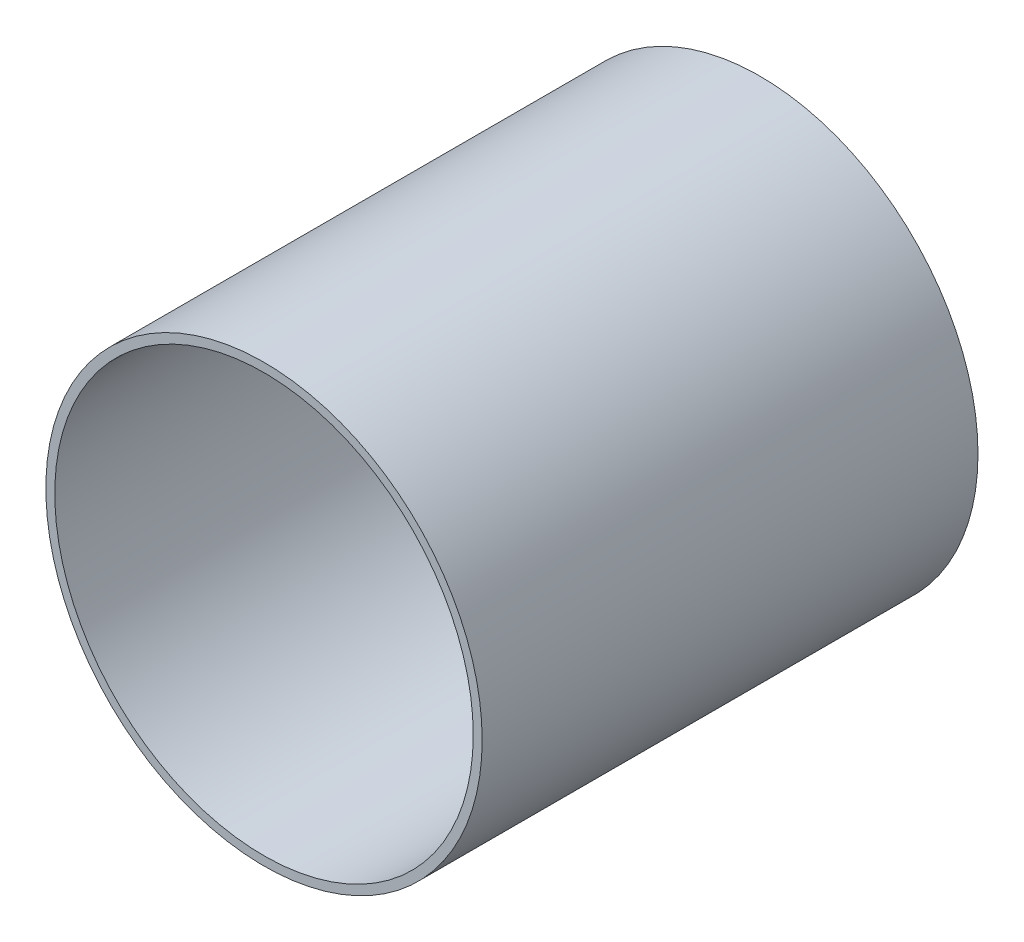
from build123d import *

# Parameters (mm, degrees)
SKETCH1_R           = 11
SKETCH1_R_2         = 10.55
BOSS_EXTRUDE1_DEPTH = 25


with BuildPart() as part:
    # Sketch1 → Boss-Extrude1 (new body)
    with BuildSketch(Plane.XY):
        Circle(SKETCH1_R)
        Circle(SKETCH1_R_2, mode=Mode.SUBTRACT)
    extrude(amount=BOSS_EXTRUDE1_DEPTH)


solid = part.part
